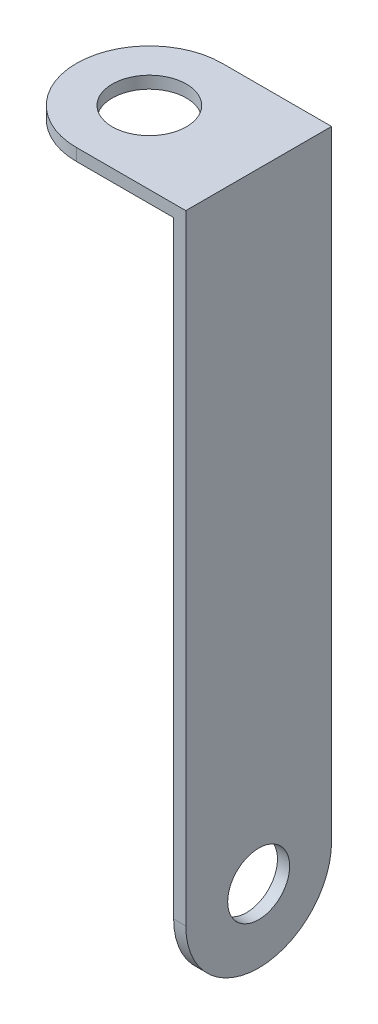
from build123d import *

# Parameters (mm, degrees)
SKETCH1_R           = 3.05
BOSS_EXTRUDE1_DEPTH = 1
BOSS_EXTRUDE2_START = 9
SKETCH3_R           = 2.55
BOSS_EXTRUDE2_DEPTH = 1


with BuildPart() as part:
    # Sketch1 → Boss-Extrude1 (new body)
    with BuildSketch(Plane(origin=(0, 0, 0), x_dir=(1, 0, 0), z_dir=(0, 1, 0))):
        with BuildLine():
            Line((0, 6), (9, 6))
            Line((9, 6), (9, -6))
            Line((9, -6), (0, -6))
            ThreePointArc((0, -6), (-6, 0), (0, 6))
        make_face()
        with Locations(Location((0, 0, 0), (0, 0, 270))):
            Circle(SKETCH1_R, mode=Mode.SUBTRACT)
    extrude(amount=BOSS_EXTRUDE1_DEPTH)

    # Sketch3 → Boss-Extrude2 (add)
    with BuildSketch(Plane(origin=(0, 0, 0), x_dir=(0, 0, -1), z_dir=(1, 0, 0)).offset(BOSS_EXTRUDE2_START)):
        with BuildLine():
            Line((-6, 0), (6, 0))
            Line((6, 0), (6, -50))
            ThreePointArc((6, -50), (0, -56), (-6, -50))
            Line((-6, -50), (-6, 0))
        make_face()
        with Locations(Location((0, -50, 0), (0, 0, 180))):
            Circle(SKETCH3_R, mode=Mode.SUBTRACT)
    extrude(amount=-BOSS_EXTRUDE2_DEPTH)


solid = part.part
